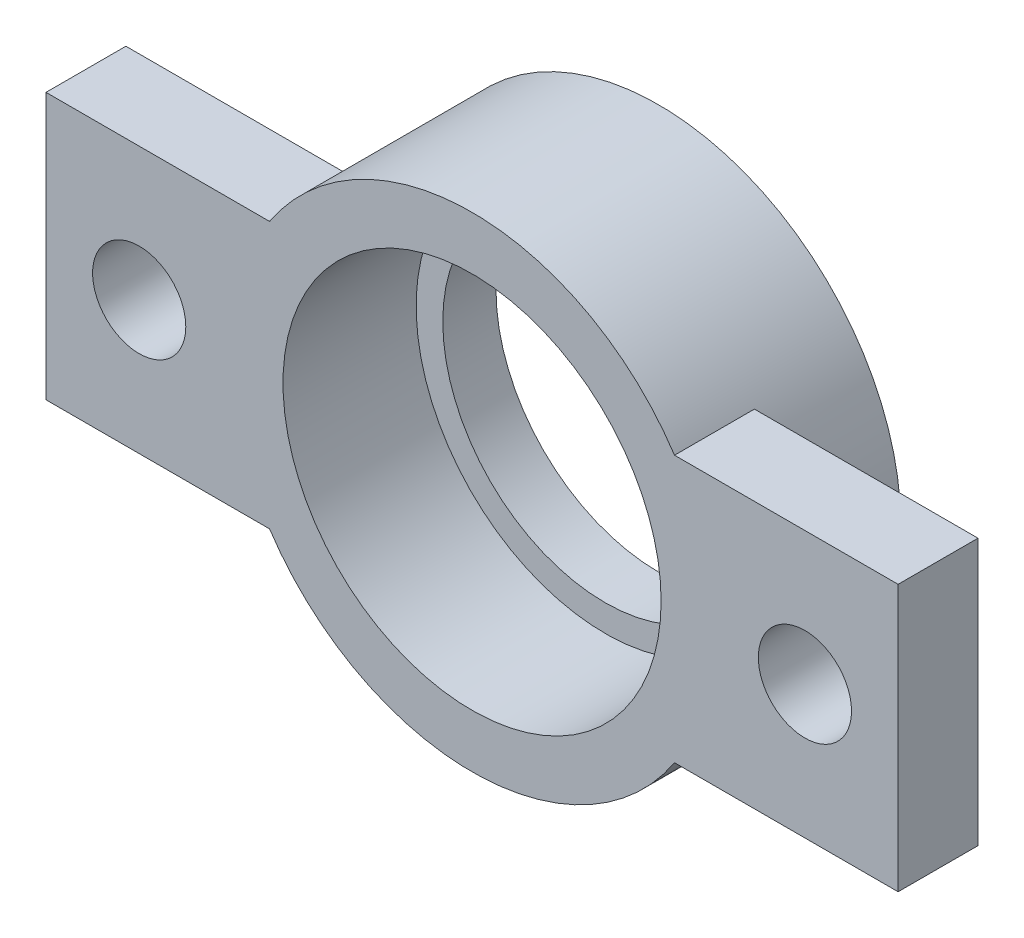
from build123d import *
from build123d.topology import SkipClean

# Parameters (mm, degrees)
SKETCH_1_R      = 1.75
EXTRUDE_1_DEPTH = 3
EXTRUDE_START   = 4
SKETCH_2_R      = 9.1
SKETCH_2_R_2    = 7.1
EXTRUDE_2_DEPTH = 4
SKETCH_3_R      = 7.1
SKETCH_3_R_2    = 6.1
EXTRUDE_3_DEPTH = 2


with BuildPart() as part:
    # Эскиз1 → Бобышка-Вытянуть1 (new body)
    # profile 1 of 8: a face of its own
    with BuildSketch(Plane.XY):
        with BuildLine():
            Line((-16, 5), (-16, -5))
            Line((-16, -5), (-7.603288762, -5))
            ThreePointArc((-7.603288762, -5), (-9.1, 0), (-7.603288762, 5))
            Line((-7.603288762, 5), (-16, 5))
        make_face()
        with Locations((-12.5, 0)):
            Circle(SKETCH_1_R, mode=Mode.SUBTRACT)
    # profile 2 of 8: a face of its own
    with BuildSketch(Plane.XY):
        with BuildLine():
            ThreePointArc((-7.603288762, 5), (-9.1, 0), (-7.603288762, -5))
            Line((-7.603288762, -5), (-5.040833264, -5))
            ThreePointArc((-5.040833264, -5), (-7.1, 0), (-5.040833264, 5))
            Line((-5.040833264, 5), (-7.603288762, 5))
        make_face()
    # profile 3 of 8: a face of its own
    with BuildSketch(Plane.XY):
        with BuildLine():
            Line((5.040833264, -5), (7.603288762, -5))
            ThreePointArc((7.603288762, -5), (8.717795815, -2.609604593), (9.1, 0))
            ThreePointArc((9.1, 0), (8.717795815, 2.609604593), (7.603288762, 5))
            Line((7.603288762, 5), (5.040833264, 5))
            ThreePointArc((5.040833264, 5), (6.565055833, 2.703708918), (7.1, 0))
            ThreePointArc((7.1, 0), (6.565055833, -2.703708918), (5.040833264, -5))
        make_face()
    # profile 4 of 8: a face of its own
    with BuildSketch(Plane.XY):
        with BuildLine():
            ThreePointArc((7.603288762, 5), (0, 9.1), (-7.603288762, 5))
            Line((-7.603288762, 5), (-5.040833264, 5))
            ThreePointArc((-5.040833264, 5), (0, 7.1), (5.040833264, 5))
            Line((5.040833264, 5), (7.603288762, 5))
        make_face()
    # profile 5 of 8: a face of its own
    with BuildSketch(Plane.XY):
        with BuildLine():
            ThreePointArc((-7.603288762, 5), (-9.1, 0), (-7.603288762, -5))
            Line((-7.603288762, -5), (-5.040833264, -5))
            ThreePointArc((-5.040833264, -5), (-7.1, 0), (-5.040833264, 5))
            Line((-5.040833264, 5), (-7.603288762, 5))
        make_face()
    # profile 6 of 8: a face of its own
    with BuildSketch(Plane.XY):
        with BuildLine():
            Line((5.040833264, -5), (7.603288762, -5))
            ThreePointArc((7.603288762, -5), (8.717795815, -2.609604593), (9.1, 0))
            ThreePointArc((9.1, 0), (8.717795815, 2.609604593), (7.603288762, 5))
            Line((7.603288762, 5), (5.040833264, 5))
            ThreePointArc((5.040833264, 5), (6.565055833, 2.703708918), (7.1, 0))
            ThreePointArc((7.1, 0), (6.565055833, -2.703708918), (5.040833264, -5))
        make_face()
    # profile 7 of 8: a face of its own
    with BuildSketch(Plane.XY):
        with BuildLine():
            ThreePointArc((9.1, 0), (8.717795815, -2.609604593), (7.603288762, -5))
            Line((7.603288762, -5), (16, -5))
            Line((16, -5), (16, 5))
            Line((16, 5), (7.603288762, 5))
            ThreePointArc((7.603288762, 5), (8.717795815, 2.609604593), (9.1, 0))
        make_face()
        with Locations((12.5, 0)):
            Circle(SKETCH_1_R, mode=Mode.SUBTRACT)
    # profile 8 of 8: a face of its own
    with BuildSketch(Plane.XY):
        with BuildLine():
            Line((-5.040833264, -5), (-7.603288762, -5))
            ThreePointArc((-7.603288762, -5), (0, -9.1), (7.603288762, -5))
            Line((7.603288762, -5), (5.040833264, -5))
            ThreePointArc((5.040833264, -5), (0, -7.1), (-5.040833264, -5))
        make_face()
    extrude(amount=EXTRUDE_1_DEPTH)

    # Эскиз2 → Бобышка-Вытянуть2 (add)
    with SkipClean():  # the faces are left unmerged after this step: merging them gives an invalid solid
        with BuildSketch(Plane(origin=(0, 0, 0), x_dir=(-1, 0, 0), z_dir=(0, 0, -1)).offset(EXTRUDE_START)):
            Circle(SKETCH_2_R)
            Circle(SKETCH_2_R_2, mode=Mode.SUBTRACT)
        extrude(amount=-EXTRUDE_2_DEPTH)

    # Эскиз3 → Бобышка-Вытянуть3 (add)
    with SkipClean():  # the faces are left unmerged after this step: merging them gives an invalid solid
        with BuildSketch(Plane.XY.offset(-4)):
            Circle(SKETCH_3_R)
            Circle(SKETCH_3_R_2, mode=Mode.SUBTRACT)
        extrude(amount=EXTRUDE_3_DEPTH)


solid = part.part
